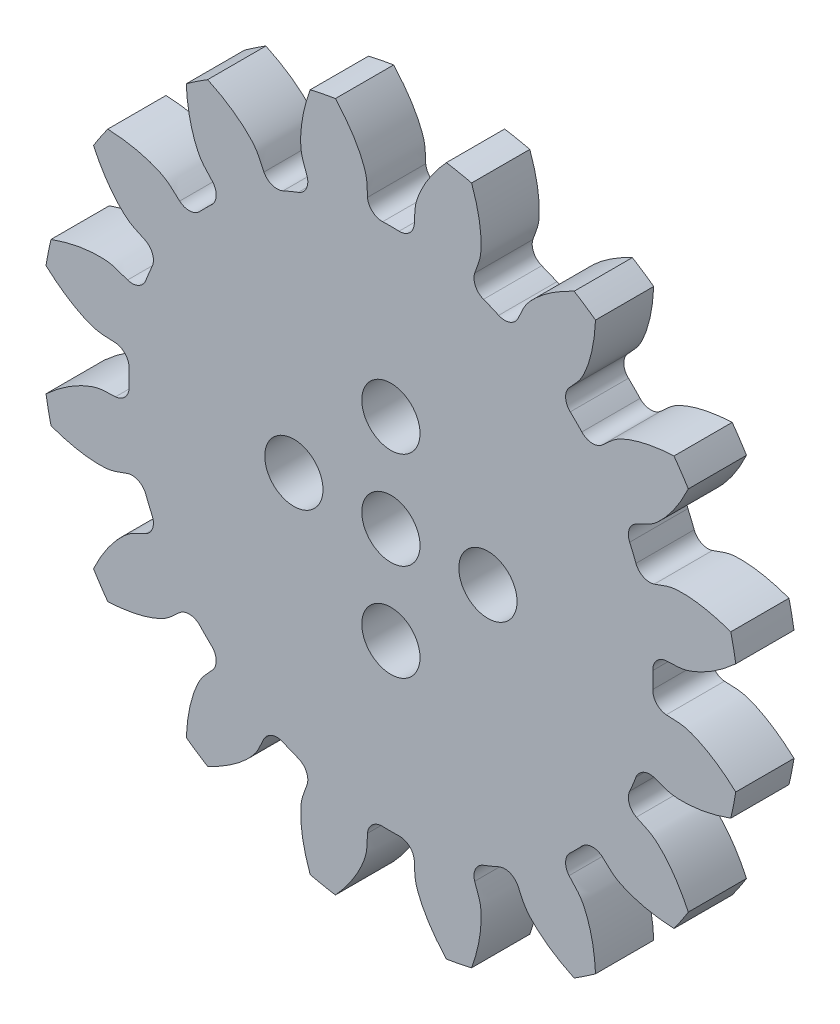
from build123d import *

# Parameters (mm, degrees)
SKETCH_1_R          = 18
LASHENA_DEPTH       = 3
CUT_EXTRUDEA_DEPTH  = 3
WWW_KYTOOL_CN_COUNT = 16
SKETCH_3_R          = 1.5
CUT_EXTRUDE_2_DEPTH = 10
SKETCH_4_R          = 1.5
CUT_EXTRUDE_3_DEPTH = 10


with BuildPart() as part:
    # 草图1 → LaShenA (new body)
    with BuildSketch(Plane.XY):
        Circle(SKETCH_1_R)
    extrude(amount=LASHENA_DEPTH)

    # SketchA → Cut-ExtrudeA (cut)
    with BuildSketch(Plane.XY.offset(3)):
        with BuildLine():
            ThreePointArc((0.423212707, 13.493364703), (0, 13.5), (-0.423212707, 13.493364703))
            ThreePointArc((-0.423212707, 13.493364703), (-0.952770902, 13.685686791), (-1.20440395, 14.18977059))
            add(Edge.make_bspline(
                [(-1.20440395, 14.18977059), (-1.226562505, 14.455224305), (-1.213843633, 14.773889884), (-1.273675597, 15.110607864), (-1.299119688, 15.21139578), (-1.321432077, 15.29109757), (-1.349914152, 15.382250837), (-1.385146673, 15.484587535), (-1.427834192, 15.597770763), (-1.478623281, 15.721446817), (-1.538159915, 15.855229004), (-1.607069773, 15.998703507), (-1.685962928, 16.151428337), (-1.775430978, 16.312934487), (-1.876046532, 16.482726463), (-1.98836201, 16.660283053), (-2.112908684, 16.845058076), (-2.250195688, 17.036481179), (-2.400709063, 17.233958676), (-2.56491084, 17.43687441), (-2.743238138, 17.644590662), (-2.936102365, 17.856449073), (-3.14388814, 18.07177164), (-3.447378451, 18.368492697), (-3.689495989, 18.585006365), (-3.858042439, 18.727457792)],
                knots=[0.122308221, 0.122308221, 0.122308221, 0.122308221, 0.250610689, 0.276296194, 0.287604067, 0.300967916, 0.316387742, 0.333863545, 0.353395324, 0.37498308, 0.398626813, 0.424326522, 0.452082207, 0.48189387, 0.513761509, 0.547685125, 0.583664717, 0.621700286, 0.661791832, 0.703939355, 0.748142854, 0.79440233, 0.842717782, 0.893089212, 1, 1, 1, 1], degree=3))
            ThreePointArc((-3.858042439, 18.727457792), (0, 19.120726106), (3.858042439, 18.727457792))
            add(Edge.make_bspline(
                [(1.20440395, 14.18977059), (1.226562505, 14.455224305), (1.213843633, 14.773889884), (1.273675597, 15.110607864), (1.299119688, 15.21139578), (1.321432077, 15.29109757), (1.349914152, 15.382250837), (1.385146673, 15.484587535), (1.427834192, 15.597770763), (1.478623281, 15.721446817), (1.538159915, 15.855229004), (1.607069773, 15.998703507), (1.685962928, 16.151428337), (1.775430978, 16.312934487), (1.876046532, 16.482726463), (1.98836201, 16.660283053), (2.112908684, 16.845058076), (2.250195688, 17.036481179), (2.400709063, 17.233958676), (2.56491084, 17.43687441), (2.743238138, 17.644590662), (2.936102365, 17.856449073), (3.14388814, 18.07177164), (3.447378451, 18.368492697), (3.689495989, 18.585006365), (3.858042439, 18.727457792)],
                knots=[0.122308221, 0.122308221, 0.122308221, 0.122308221, 0.250610689, 0.276296194, 0.287604067, 0.300967916, 0.316387742, 0.333863545, 0.353395324, 0.37498308, 0.398626813, 0.424326522, 0.452082207, 0.48189387, 0.513761509, 0.547685125, 0.583664717, 0.621700286, 0.661791832, 0.703939355, 0.748142854, 0.79440233, 0.842717782, 0.893089212, 1, 1, 1, 1], degree=3))
            ThreePointArc((1.20440395, 14.18977059), (0.952770902, 13.685686791), (0.423212707, 13.493364703))
        make_face()
    cut_extrudea = extrude(amount=-CUT_EXTRUDEA_DEPTH, mode=Mode.SUBTRACT)

    # www.KYTool.cn: Cut-ExtrudeA ×16 about axis
    www_kytool_cn_axis = Axis((0, 0, -80.9), (0, 0, 1))
    for i in range(1, WWW_KYTOOL_CN_COUNT):
        add(cut_extrudea.rotate(www_kytool_cn_axis, i * 360 / WWW_KYTOOL_CN_COUNT), mode=Mode.SUBTRACT)

    # 草图3 → 切除-拉伸2 (cut)
    with BuildSketch(Plane(origin=(0, 0, 0), x_dir=(-1, 0, 0), z_dir=(0, 0, -1))):
        Circle(SKETCH_3_R)
    extrude(amount=-CUT_EXTRUDE_2_DEPTH, mode=Mode.SUBTRACT)

    # 草图4 → 切除-拉伸3 (cut)
    with BuildSketch(Plane(origin=(0, 0, 0), x_dir=(-1, 0, 0), z_dir=(0, 0, -1))):
        with Locations((5, 0)):
            Circle(SKETCH_4_R)
        with Locations((0, -5)):
            Circle(SKETCH_4_R)
        with Locations((-5, 0)):
            Circle(SKETCH_4_R)
        with Locations((0, 5)):
            Circle(SKETCH_4_R)
    extrude(amount=-CUT_EXTRUDE_3_DEPTH, mode=Mode.SUBTRACT)


solid = part.part
